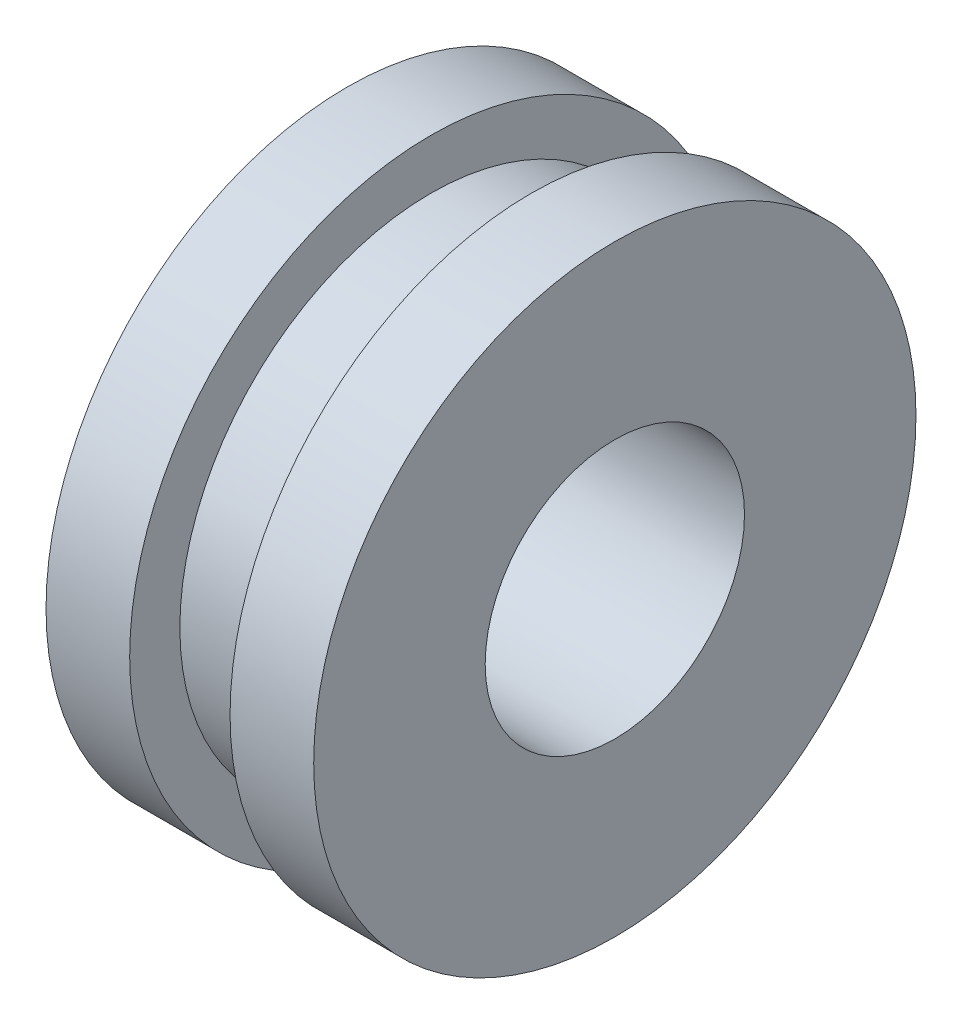
from build123d import *

# Parameters (mm, degrees)
SKETCH1_W = 8
SKETCH1_H = 8


with BuildPart() as part:
    # Sketch1 → Revolve1 (revolve)
    with BuildSketch(Plane.XY, mode=Mode.PRIVATE) as revolve1_sk:
        with Locations((0, 6)):
            Rectangle(SKETCH1_W, SKETCH1_H)
    revolve(revolve1_sk.sketch.rotate(Axis((0, 0, 0), (1, 0, 0)), 90), axis=Axis((0, 0, 0), (1, 0, 0)))

    # Sketch2 → Cut-Revolve1 (revolve, cut)
    with BuildSketch(Plane.XY, mode=Mode.PRIVATE) as cut_revolve1_sk:
        Polygon((-4, 4.5), (-3.25, 4.5), (-3.25, 3.875), (4, 3.875), (4, 1.375), (-4, 1.375), align=None)
    revolve(cut_revolve1_sk.sketch.rotate(Axis((-4, 0, 0), (1, 0, 0)), 90), axis=Axis((-4, 0, 0), (1, 0, 0)), mode=Mode.SUBTRACT)

    # Sketch5 → Cut-Revolve2 (revolve, cut)
    with BuildSketch(Plane.XY, mode=Mode.PRIVATE) as cut_revolve2_sk:
        Polygon((-5.693293246, 11), (6.09167682, 11), (6.09167682, 9), (1.5, 9), (1.5, 7.5), (-1.5, 7.5), (-1.5, 9), (-5.693293246, 9), align=None)
    revolve(cut_revolve2_sk.sketch.rotate(Axis((-5.693293246, 0, 0), (1, 0, 0)), 90), axis=Axis((-5.693293246, 0, 0), (1, 0, 0)), mode=Mode.SUBTRACT)


solid = part.part
